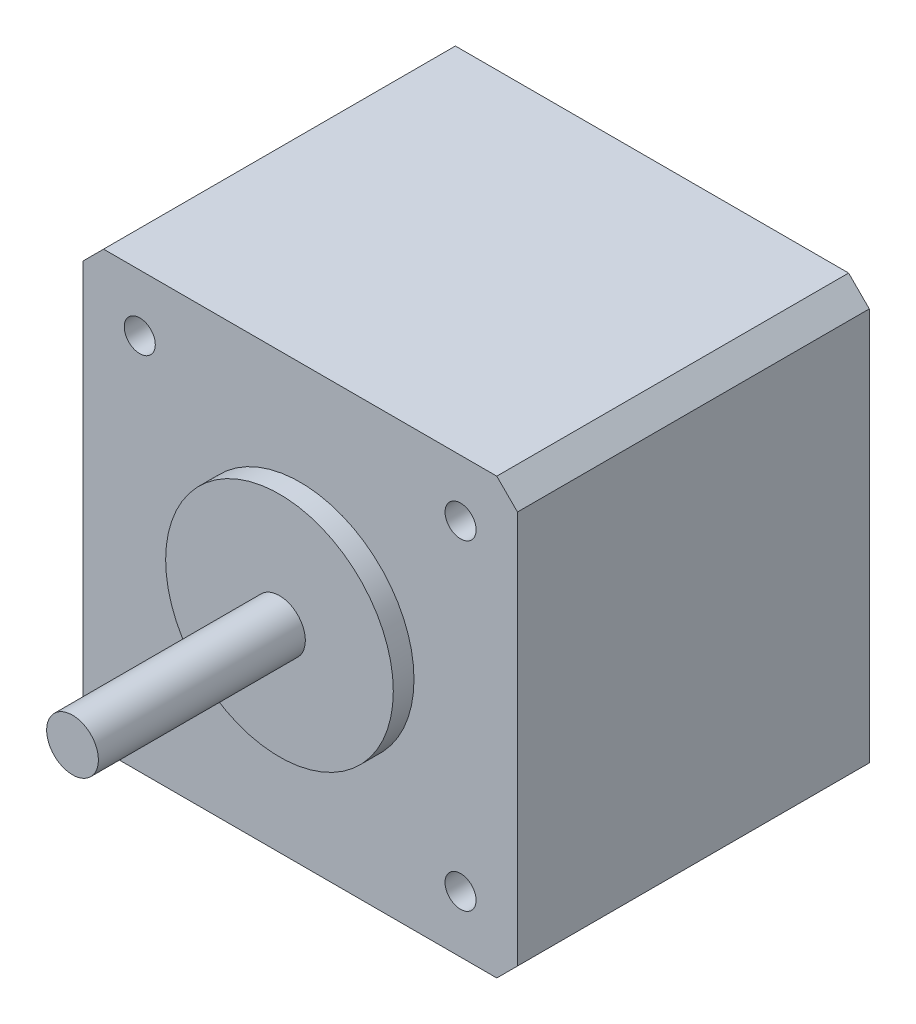
from build123d import *

# Parameters (mm, degrees)
SKETCH_1_W      = 42
SKETCH_1_H      = 42
SKETCH_1_R      = 1.5
EXTRUDE_1_DEPTH = 34
SKETCH_1_3_R    = 11
EXTRUDE_2_DEPTH = 2
SKETCH_1_4_R    = 2.5
EXTRUDE_3_DEPTH = 22
CHAMFER_1_SIZE  = 2


with BuildPart() as part:
    # 스케치1 → 보스-돌출1 (new body)
    with BuildSketch(Plane.XY):
        Rectangle(SKETCH_1_W, SKETCH_1_H)
        with Locations((-15.5, -15.5)):
            Circle(SKETCH_1_R, mode=Mode.SUBTRACT)
        with Locations((15.5, -15.5)):
            Circle(SKETCH_1_R, mode=Mode.SUBTRACT)
        with Locations((-15.5, 15.5)):
            Circle(SKETCH_1_R, mode=Mode.SUBTRACT)
        with Locations((15.5, 15.5)):
            Circle(SKETCH_1_R, mode=Mode.SUBTRACT)
    extrude(amount=-EXTRUDE_1_DEPTH)

    # 스케치1<3> → 보스-돌출2 (add)
    with BuildSketch(Plane.XY):
        Circle(SKETCH_1_3_R)
    extrude(amount=EXTRUDE_2_DEPTH)

    # 스케치1<4> → 보스-돌출3 (add)
    with BuildSketch(Plane.XY):
        Circle(SKETCH_1_4_R)
    extrude(amount=EXTRUDE_3_DEPTH)

    # 모따기1
    chamfer_1_edges = [part.edges().sort_by_distance(p)[0] for p in [
        (-21, 21, -17),
        (21, 21, -17),
        (21, -21, -17),
        (-21, -21, -17),
    ]]
    chamfer(chamfer_1_edges, length=CHAMFER_1_SIZE)


solid = part.part
